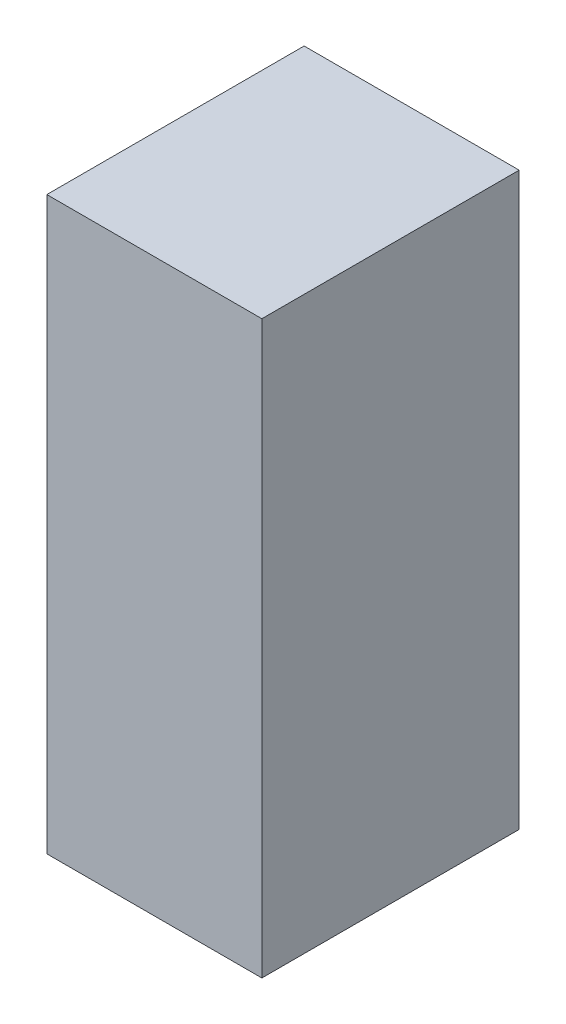
from build123d import *

# Parameters (mm, degrees)
SKETCH1_W           = 29
SKETCH1_H           = 34.7
BOSS_EXTRUDE1_DEPTH = 77


with BuildPart() as part:
    # Sketch1 → Boss-Extrude1 (new body)
    with BuildSketch(Plane(origin=(0, 0, 0), x_dir=(1, 0, 0), z_dir=(0, 1, 0))):
        with Locations((14.5, 17.35)):
            Rectangle(SKETCH1_W, SKETCH1_H)
    extrude(amount=BOSS_EXTRUDE1_DEPTH)


solid = part.part
